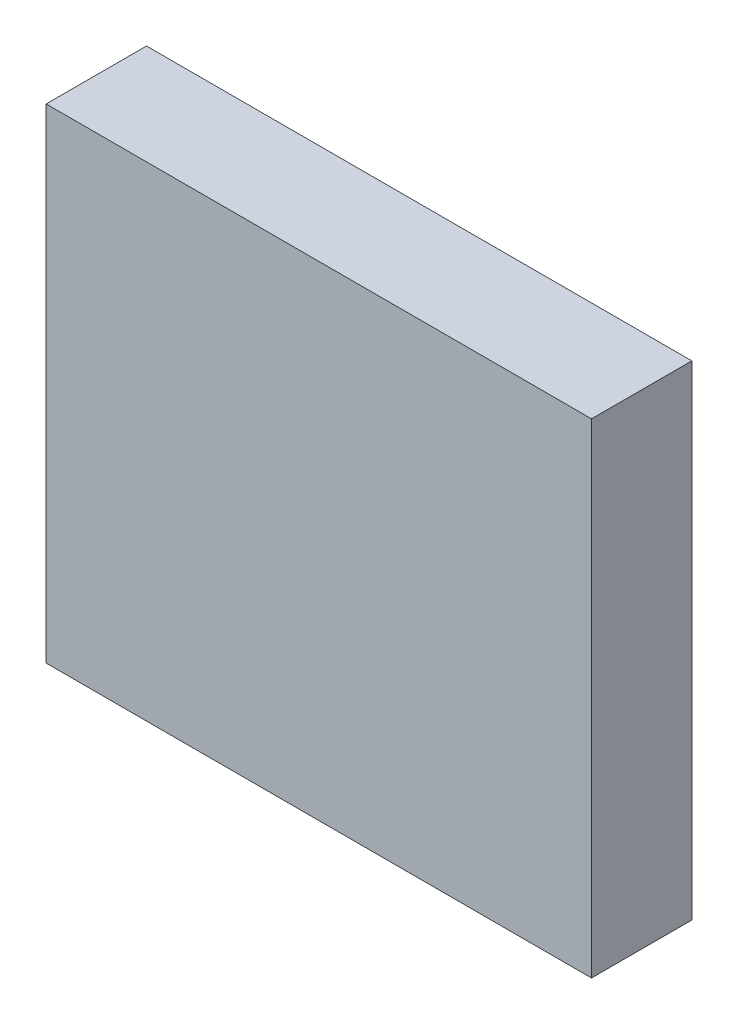
from build123d import *

# Parameters (mm, degrees)
SKETCH_1_W          = 90
SKETCH_1_H          = 90
EXTRUDE_1_DEPTH     = 1.6
SKETCH_4_W          = 17.78
SKETCH_4_H          = 8.5
SKETCH_4_W_2        = 2.5
SKETCH_4_H_2        = 17.78
SKETCH_4_W_3        = 8.5
EXTRUDE_2_DEPTH     = 2.5
SKETCH_5_W          = 0.64
SKETCH_5_H          = 0.64
EXTRUDE_3_DEPTH     = 6.1
SKETCH_6_W          = 3.48
SKETCH_6_H          = 3.48
EXTRUDE_4_DEPTH     = 2
SKETCH_7_W          = 2
SKETCH_7_H          = 4
SKETCH_7_W_2        = 4
SKETCH_7_H_2        = 2
EXTRUDE_5_DEPTH     = 1.1
SKETCH_8_W          = 7.4
SKETCH_8_H          = 15.2
EXTRUDE_6_DEPTH     = 2.65
SKETCH_9_W          = 0.64
SKETCH_9_H          = 0.64
CUT_EXTRUDE_1_DEPTH = 7.5
SKETCH_10_W         = 0.64
SKETCH_10_H         = 0.64
CUT_EXTRUDE_2_DEPTH = 7.5
SKETCH_11_W         = 0.64
SKETCH_11_H         = 0.64
CUT_EXTRUDE_3_DEPTH = 7.5
EXTRUDE_7_DEPTH     = 3
SKETCH_13_R         = 1
EXTRUDE_8_DEPTH     = 2
SKETCH_14_W         = 101.35
SKETCH_14_H         = 90
EXTRUDE_9_DEPTH     = 18.65


with BuildPart() as part:
    # ｽｹｯﾁ1 → ﾎﾞｽ - 押し出し1 (new body)
    with BuildSketch(Plane.XY):
        Rectangle(SKETCH_1_W, SKETCH_1_H)
    extrude(amount=EXTRUDE_1_DEPTH)

    # ｽｹｯﾁ4 → ﾎﾞｽ - 押し出し2 (add)
    with BuildSketch(Plane(origin=(0, 0, 0), x_dir=(-1, 0, 0), z_dir=(0, 0, -1))):
        with Locations((-15, -40.35)):
            Rectangle(SKETCH_4_W, SKETCH_4_H)
        with Locations((-37.6, 18)):
            Rectangle(SKETCH_4_W_2, SKETCH_4_H_2)
        with Locations((25, 40.35)):
            Rectangle(SKETCH_4_W, SKETCH_4_H)
        with Locations((40.35, 18)):
            Rectangle(SKETCH_4_W_3, SKETCH_4_H_2)
    extrude(amount=EXTRUDE_2_DEPTH)

    # ｽｹｯﾁ5 → ﾎﾞｽ - 押し出し3 (add)
    with BuildSketch(Plane(origin=(0, 0, -2.5), x_dir=(-1, 0, 0), z_dir=(0, 0, -1))):
        with Locations((-37.6, 18)):
            Rectangle(SKETCH_5_W, SKETCH_5_H)
        with Locations((-37.6, 15.46)):
            Rectangle(SKETCH_5_W, SKETCH_5_H)
        with Locations((-37.6, 12.92)):
            Rectangle(SKETCH_5_W, SKETCH_5_H)
        with Locations((-37.6, 10.38)):
            Rectangle(SKETCH_5_W, SKETCH_5_H)
        with Locations((-37.6, 20.54)):
            Rectangle(SKETCH_5_W, SKETCH_5_H)
        with Locations((-37.6, 23.08)):
            Rectangle(SKETCH_5_W, SKETCH_5_H)
        with Locations((-37.6, 25.62)):
            Rectangle(SKETCH_5_W, SKETCH_5_H)
    extrude(amount=EXTRUDE_3_DEPTH)

    # ｽｹｯﾁ6 → ﾎﾞｽ - 押し出し4 (add)
    with BuildSketch(Plane.XY.offset(1.6)):
        with Locations((-40, -35)):
            Rectangle(SKETCH_6_W, SKETCH_6_H)
        with Locations((-40, 35)):
            Rectangle(SKETCH_6_W, SKETCH_6_H)
        with Locations((30, -35)):
            Rectangle(SKETCH_6_W, SKETCH_6_H)
        with Locations((30, 35)):
            Rectangle(SKETCH_6_W, SKETCH_6_H)
    extrude(amount=EXTRUDE_4_DEPTH)

    # ｽｹｯﾁ7 → ﾎﾞｽ - 押し出し5 (add)
    with BuildSketch(Plane.XY.offset(1.6)):
        with Locations((-40, 0)):
            Rectangle(SKETCH_7_W, SKETCH_7_H)
        with Locations((30, 0)):
            Rectangle(SKETCH_7_W, SKETCH_7_H)
        with Locations((-5, 35)):
            Rectangle(SKETCH_7_W_2, SKETCH_7_H_2)
        with Locations((-5, -35)):
            Rectangle(SKETCH_7_W_2, SKETCH_7_H_2)
        with Locations((-5, 0)):
            Rectangle(SKETCH_7_W, SKETCH_7_H)
    extrude(amount=EXTRUDE_5_DEPTH)

    # ｽｹｯﾁ8 → ﾎﾞｽ - 押し出し6 (add)
    with BuildSketch(Plane.XY.offset(1.6)):
        with Locations((11, 0)):
            Rectangle(SKETCH_8_W, SKETCH_8_H)
    extrude(amount=EXTRUDE_6_DEPTH)

    # ｽｹｯﾁ9 → ｶｯﾄ - 押し出し1 (cut)
    with BuildSketch(Plane.XZ.offset(44.6)):
        with Locations((15, -1.25)):
            Rectangle(SKETCH_9_W, SKETCH_9_H)
        with Locations((12.46, -1.25)):
            Rectangle(SKETCH_9_W, SKETCH_9_H)
        with Locations((9.92, -1.25)):
            Rectangle(SKETCH_9_W, SKETCH_9_H)
        with Locations((7.38, -1.25)):
            Rectangle(SKETCH_9_W, SKETCH_9_H)
        with Locations((17.54, -1.25)):
            Rectangle(SKETCH_9_W, SKETCH_9_H)
        with Locations((20.08, -1.25)):
            Rectangle(SKETCH_9_W, SKETCH_9_H)
        with Locations((22.62, -1.25)):
            Rectangle(SKETCH_9_W, SKETCH_9_H)
    extrude(amount=-CUT_EXTRUDE_1_DEPTH, mode=Mode.SUBTRACT)

    # ｽｹｯﾁ10 → ｶｯﾄ - 押し出し2 (cut)
    with BuildSketch(Plane.ZY.offset(44.6)):
        with Locations((-1.25, 18)):
            Rectangle(SKETCH_10_W, SKETCH_10_H)
        with Locations((-1.25, 25.62)):
            Rectangle(SKETCH_10_W, SKETCH_10_H)
        with Locations((-1.25, 23.08)):
            Rectangle(SKETCH_10_W, SKETCH_10_H)
        with Locations((-1.25, 20.54)):
            Rectangle(SKETCH_10_W, SKETCH_10_H)
        with Locations((-1.25, 15.46)):
            Rectangle(SKETCH_10_W, SKETCH_10_H)
        with Locations((-1.25, 12.92)):
            Rectangle(SKETCH_10_W, SKETCH_10_H)
        with Locations((-1.25, 10.38)):
            Rectangle(SKETCH_10_W, SKETCH_10_H)
    extrude(amount=-CUT_EXTRUDE_2_DEPTH, mode=Mode.SUBTRACT)

    # ｽｹｯﾁ11 → ｶｯﾄ - 押し出し3 (cut)
    with BuildSketch(Plane(origin=(0, 44.6, 0), x_dir=(1, 0, 0), z_dir=(0, 1, 0))):
        with Locations((-25, 1.25)):
            Rectangle(SKETCH_11_W, SKETCH_11_H)
        with Locations((-32.62, 1.25)):
            Rectangle(SKETCH_11_W, SKETCH_11_H)
        with Locations((-30.08, 1.25)):
            Rectangle(SKETCH_11_W, SKETCH_11_H)
        with Locations((-27.54, 1.25)):
            Rectangle(SKETCH_11_W, SKETCH_11_H)
        with Locations((-22.46, 1.25)):
            Rectangle(SKETCH_11_W, SKETCH_11_H)
        with Locations((-19.92, 1.25)):
            Rectangle(SKETCH_11_W, SKETCH_11_H)
        with Locations((-17.38, 1.25)):
            Rectangle(SKETCH_11_W, SKETCH_11_H)
    extrude(amount=-CUT_EXTRUDE_3_DEPTH, mode=Mode.SUBTRACT)

    # ｽｹｯﾁ12 → ﾎﾞｽ - 押し出し7 (add)
    with BuildSketch(Plane(origin=(0, 0, 0), x_dir=(-1, 0, 0), z_dir=(0, 0, -1))):
        Polygon((-23, 30), (-24, 31.732050808), (-26, 31.732050808), (-27, 30), (-26, 28.267949192), (-24, 28.267949192), align=None)
        Polygon((37, 30), (36, 31.732050808), (34, 31.732050808), (33, 30), (34, 28.267949192), (36, 28.267949192), align=None)
        Polygon((37, -30), (36, -28.267949192), (34, -28.267949192), (33, -30), (34, -31.732050808), (36, -31.732050808), align=None)
        Polygon((-23, -30), (-24, -28.267949192), (-26, -28.267949192), (-27, -30), (-26, -31.732050808), (-24, -31.732050808), align=None)
    extrude(amount=EXTRUDE_7_DEPTH)


with BuildPart() as body_2:
    # ｽｹｯﾁ13 → ﾎﾞｽ - 押し出し8 (new body)
    with BuildSketch(Plane(origin=(0, 0, -3), x_dir=(-1, 0, 0), z_dir=(0, 0, -1))):
        Polygon((-34, 41), (-34, 0), (-36, 0), (-36, -39), (5, -39), (5, -41), (44, -41), (44, 0), (46, 0), (46, 39), (5, 39), (5, 41), align=None)
        with Locations((-25, 30)):
            Circle(SKETCH_13_R, mode=Mode.SUBTRACT)
        with Locations((-25, -30)):
            Circle(SKETCH_13_R, mode=Mode.SUBTRACT)
        with Locations((35, -30)):
            Circle(SKETCH_13_R, mode=Mode.SUBTRACT)
        with Locations((35, 30)):
            Circle(SKETCH_13_R, mode=Mode.SUBTRACT)
    extrude(amount=EXTRUDE_8_DEPTH)


with BuildPart() as body_3:
    # ｽｹｯﾁ14 → ﾎﾞｽ - 押し出し9 (new body)
    with BuildSketch(Plane(origin=(0, 0, -2.5), x_dir=(-1, 0, 0), z_dir=(0, 0, -1))):
        with Locations((-4.325, 0)):
            Rectangle(SKETCH_14_W, SKETCH_14_H)
    extrude(amount=-EXTRUDE_9_DEPTH)


solid = Compound([part.part, body_2.part, body_3.part])
